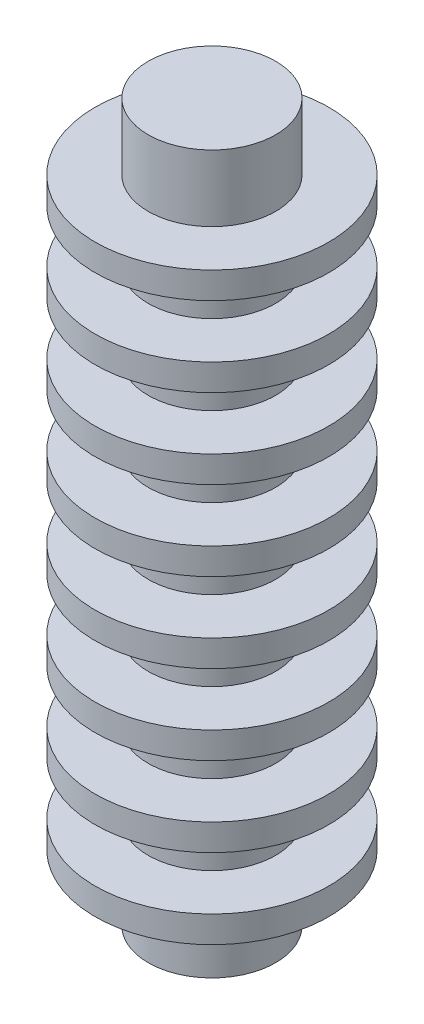
from build123d import *


with BuildPart() as part:
    # Sketch1 → Revolve1 (revolve)
    with BuildSketch(Plane.XY, mode=Mode.PRIVATE) as revolve1_sk:
        Polygon((4.8, 24), (4.8, 22), (8.8, 22), (8.8, 20), (4.8, 20.000000056), (4.8, 18), (4.8, 16), (8.8, 16), (8.8, 14), (4.8, 14), (4.8, 11), (4.8, 10), (8.8, 10), (8.8, 8), (4.8, 8), (4.8, 5), (4.8, 4), (8.8, 4), (8.8, 2), (4.8, 2), (4.8, -1), (4.8, -2), (8.8, -2), (8.8, -4), (4.8, -4), (4.8, -7), (4.8, -8), (8.8, -8), (8.8, -10), (4.8, -10), (4.8, -13), (4.8, -14), (8.8, -14), (8.8, -16), (4.8, -16), (4.8, -19), (4.8, -20), (8.8, -20), (8.8, -22), (4.8, -22), (4.8, -24), (4.8, -27), (0, -27), (0, 27), (4.8, 27), align=None)
    revolve(revolve1_sk.sketch.rotate(Axis((0, 27, 0), (0, -1, 0)), 180), axis=Axis((0, 27, 0), (0, -1, 0)))


solid = part.part
